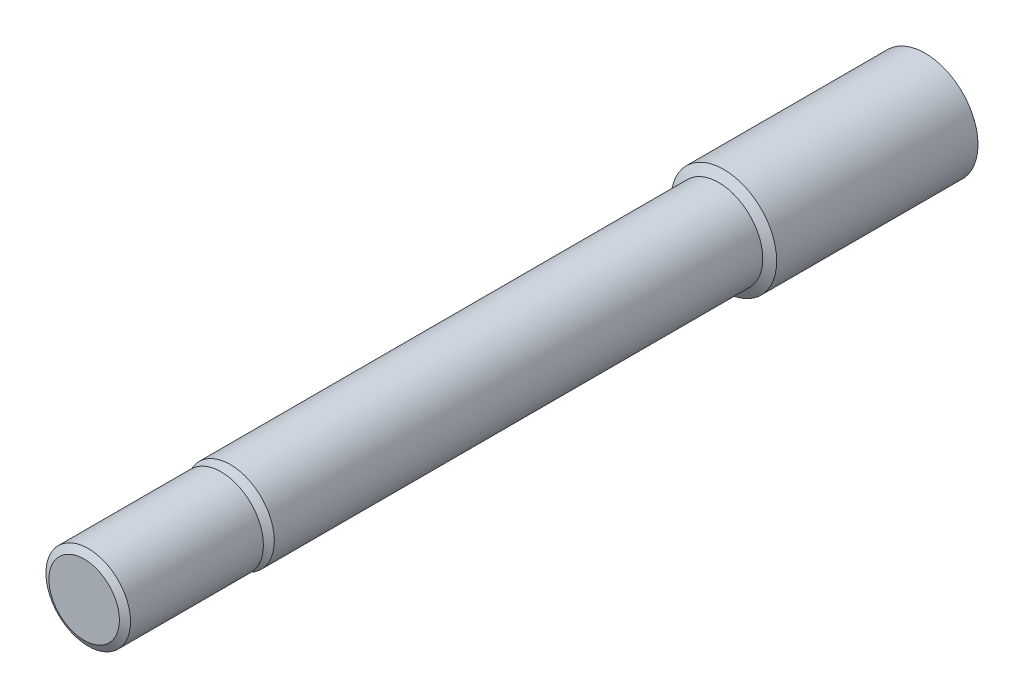
from build123d import *


with BuildPart() as part:
    # Sketch2 → Revolve1 (revolve)
    with BuildSketch(Plane(origin=(0, 0, 0), x_dir=(0, 0, -1), z_dir=(1, 0, 0)), mode=Mode.PRIVATE) as revolve1_sk:
        Polygon((0, 0), (0, 1), (0.115470054, 1.2), (3.884529946, 1.2), (4, 1), (4.144337567, 1.25), (18, 1.25), (18.144337567, 1.5), (23.855662433, 1.5), (24, 1.25), (24, 0), align=None)
    revolve(revolve1_sk.sketch.rotate(Axis((0, 0, 0), (0, 0, -1)), 90), axis=Axis((0, 0, 0), (0, 0, -1)))


solid = part.part
